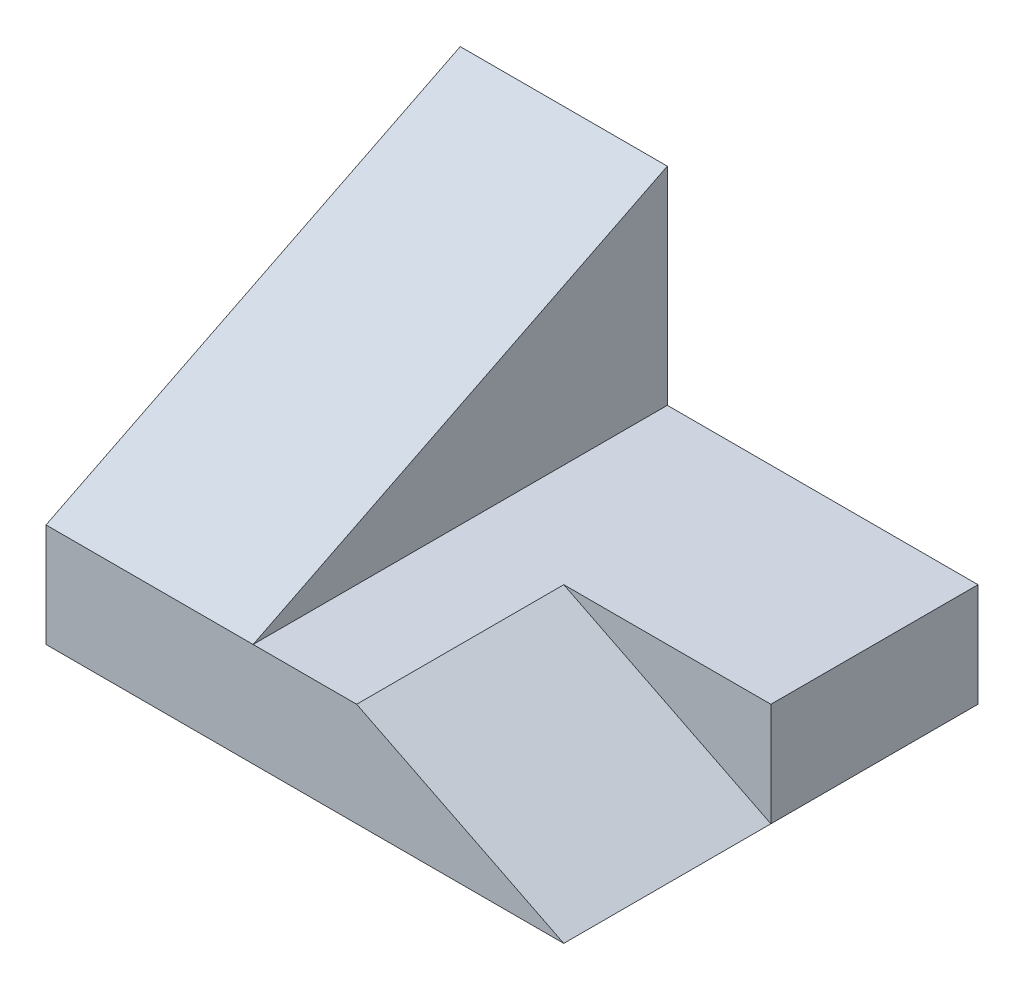
from build123d import *

# Parameters (mm, degrees)
SKETCH1_W           = 127
SKETCH1_H           = 101.6
BOSS_EXTRUDE1_DEPTH = 25.4
CUT_EXTRUDE1_DEPTH  = 50.8
BOSS_EXTRUDE2_DEPTH = 50.8


with BuildPart() as part:
    # Sketch1 → Boss-Extrude1 (new body)
    with BuildSketch(Plane(origin=(0, 0, 0), x_dir=(1, 0, 0), z_dir=(0, 1, 0))):
        Rectangle(SKETCH1_W, SKETCH1_H)
    extrude(amount=BOSS_EXTRUDE1_DEPTH)

    # Sketch2 → Cut-Extrude1 (cut)
    with BuildSketch(Plane.XY.offset(50.8)):
        Polygon((63.5, 0), (12.7, 25.4), (63.5, 25.4), align=None)
    extrude(amount=-CUT_EXTRUDE1_DEPTH, mode=Mode.SUBTRACT)


with BuildPart() as body_2:
    # Sketch3 → Boss-Extrude2 (new body)
    with BuildSketch(Plane.ZY.offset(63.5)):
        Polygon((-50.8, 25.4), (-50.8, 76.2), (50.8, 25.4), align=None)
    extrude(amount=-BOSS_EXTRUDE2_DEPTH)


solid = Compound([part.part, body_2.part])
